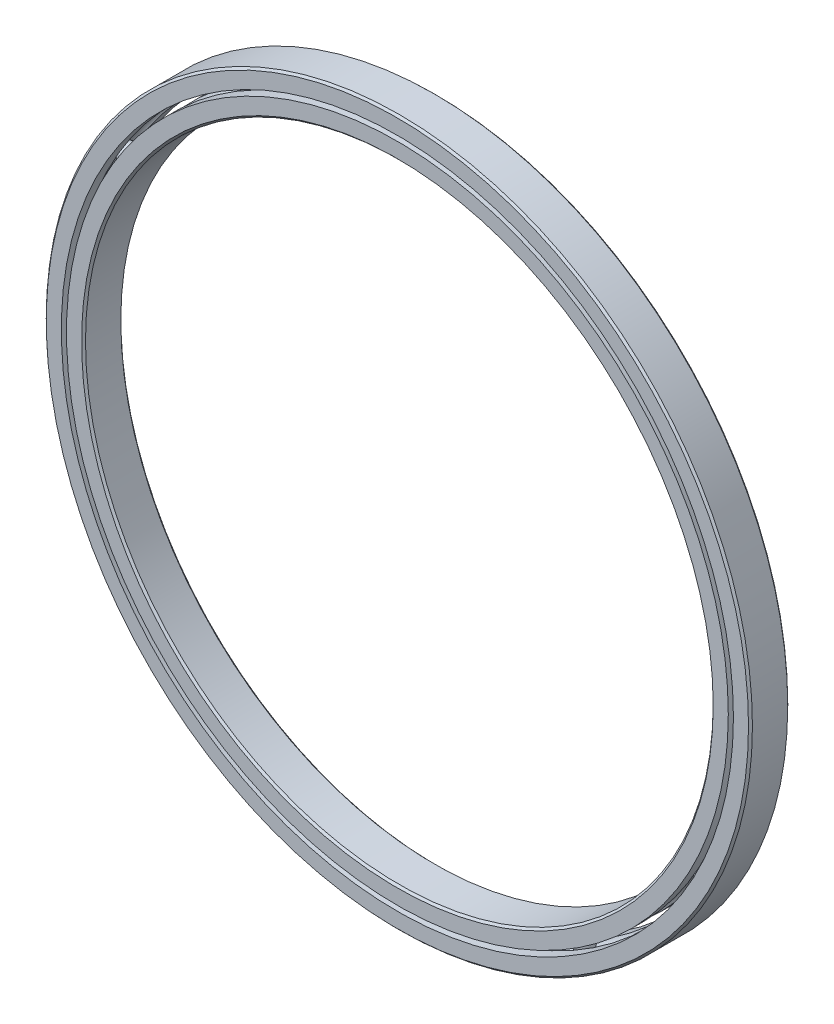
from build123d import *

# Parameters (mm, degrees)
CIRPATTERN1_COUNT = 12


with BuildPart() as part:
    # Sketch1 → Revolve1 (revolve)
    with BuildSketch(Plane(origin=(0, 0, 0), x_dir=(0, 0, -1), z_dir=(1, 0, 0))):
        with BuildLine():
            Line((2.8575, 57.15), (-2.8575, 57.15))
            Line((-2.8575, 57.15), (-3.175, 56.8325))
            Line((-3.175, 56.8325), (-3.175, 54.390192308))
            Line((-3.175, 54.390192308), (-1.411111111, 54.390192308))
            ThreePointArc((-1.411111111, 54.390192308), (0, 55.445924614), (1.411111111, 54.390192308))
            Line((1.411111111, 54.390192308), (3.175, 54.390192308))
            Line((3.175, 54.390192308), (3.175, 56.8325))
            Line((3.175, 56.8325), (2.8575, 57.15))
        make_face()
    revolve(axis=Axis((0, 0, 3.175), (0, 0, -1)))


with BuildPart() as body_2:
    # Sketch3 → Revolve3 (revolve)
    with BuildSketch(Plane(origin=(0, 0, 0), x_dir=(0, 0, -1), z_dir=(1, 0, 0))):
        with BuildLine():
            Line((-3.175, 53.559807692), (-1.411111111, 53.559807692))
            ThreePointArc((-1.411111111, 53.559807692), (0, 52.504075386), (1.411111111, 53.559807692))
            Line((1.411111111, 53.559807692), (3.175, 53.559807692))
            Line((3.175, 53.559807692), (3.175, 51.1175))
            Line((3.175, 51.1175), (2.8575, 50.8))
            Line((2.8575, 50.8), (-2.8575, 50.8))
            Line((-2.8575, 50.8), (-3.175, 51.1175))
            Line((-3.175, 51.1175), (-3.175, 53.559807692))
        make_face()
    revolve(axis=Axis((0, 0, 3.175), (0, 0, -1)))


with BuildPart() as body_3:
    # Sketch4 → Revolve4 (revolve)
    with BuildSketch(Plane(origin=(0, 0, 0), x_dir=(0, 0, -1), z_dir=(1, 0, 0))):
        with BuildLine():
            Line((-1.470924614, 53.975), (1.470924614, 53.975))
            ThreePointArc((1.470924614, 53.975), (0, 55.445924614), (-1.470924614, 53.975))
        make_face()
    revolve(axis=Axis((0, 53.975, 1.470924614), (0, 0, -1)))


with BuildPart() as cirpattern1_1:
    # CirPattern1: pattern copy
    add(body_3.part.rotate(Axis((0, 0, -3.175), (0, 0, 1)), 1 * 360 / CIRPATTERN1_COUNT))


with BuildPart() as cirpattern1_2:
    # CirPattern1: pattern copy
    add(body_3.part.rotate(Axis((0, 0, -3.175), (0, 0, 1)), 2 * 360 / CIRPATTERN1_COUNT))


with BuildPart() as cirpattern1_3:
    # CirPattern1: pattern copy
    add(body_3.part.rotate(Axis((0, 0, -3.175), (0, 0, 1)), 3 * 360 / CIRPATTERN1_COUNT))


with BuildPart() as cirpattern1_4:
    # CirPattern1: pattern copy
    add(body_3.part.rotate(Axis((0, 0, -3.175), (0, 0, 1)), 4 * 360 / CIRPATTERN1_COUNT))


with BuildPart() as cirpattern1_5:
    # CirPattern1: pattern copy
    add(body_3.part.rotate(Axis((0, 0, -3.175), (0, 0, 1)), 5 * 360 / CIRPATTERN1_COUNT))


with BuildPart() as cirpattern1_6:
    # CirPattern1: pattern copy
    add(body_3.part.rotate(Axis((0, 0, -3.175), (0, 0, 1)), 6 * 360 / CIRPATTERN1_COUNT))


with BuildPart() as cirpattern1_7:
    # CirPattern1: pattern copy
    add(body_3.part.rotate(Axis((0, 0, -3.175), (0, 0, 1)), 7 * 360 / CIRPATTERN1_COUNT))


with BuildPart() as cirpattern1_8:
    # CirPattern1: pattern copy
    add(body_3.part.rotate(Axis((0, 0, -3.175), (0, 0, 1)), 8 * 360 / CIRPATTERN1_COUNT))


with BuildPart() as cirpattern1_9:
    # CirPattern1: pattern copy
    add(body_3.part.rotate(Axis((0, 0, -3.175), (0, 0, 1)), 9 * 360 / CIRPATTERN1_COUNT))


with BuildPart() as cirpattern1_10:
    # CirPattern1: pattern copy
    add(body_3.part.rotate(Axis((0, 0, -3.175), (0, 0, 1)), 10 * 360 / CIRPATTERN1_COUNT))


with BuildPart() as cirpattern1_11:
    # CirPattern1: pattern copy
    add(body_3.part.rotate(Axis((0, 0, -3.175), (0, 0, 1)), 11 * 360 / CIRPATTERN1_COUNT))


solid = Compound([part.part, body_2.part, body_3.part, cirpattern1_1.part, cirpattern1_2.part, cirpattern1_3.part, cirpattern1_4.part, cirpattern1_5.part, cirpattern1_6.part, cirpattern1_7.part, cirpattern1_8.part, cirpattern1_9.part, cirpattern1_10.part, cirpattern1_11.part])
